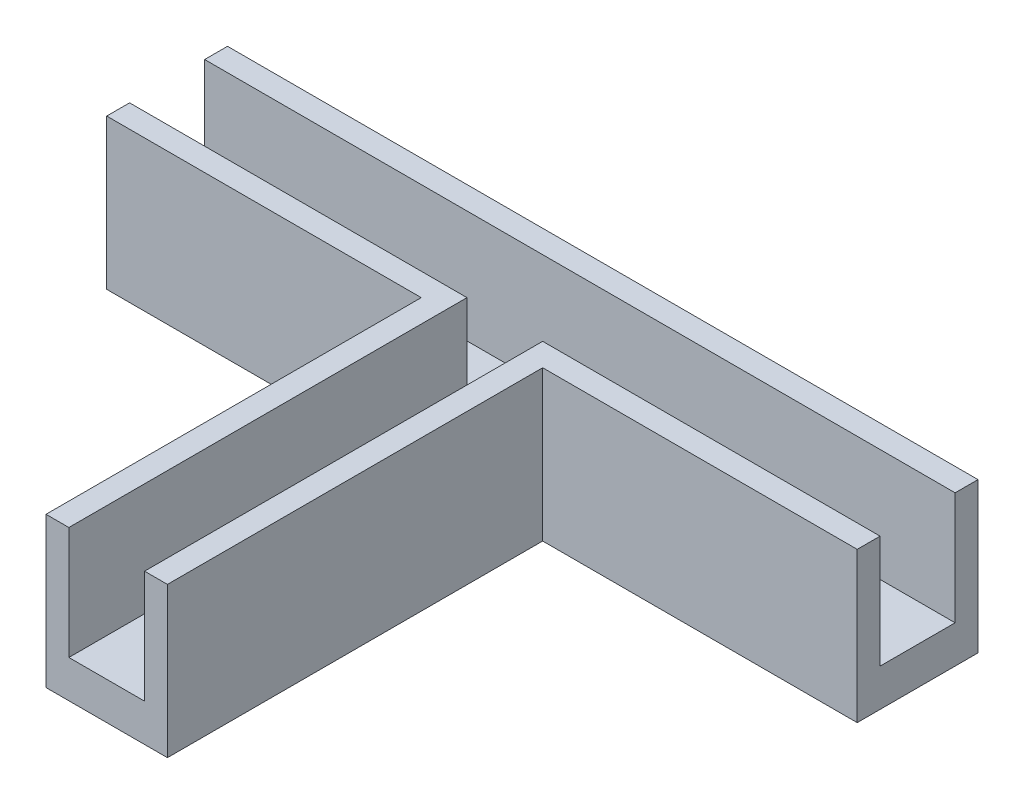
from build123d import *

# Parameters (mm, degrees)
BOSS_EXTRUDE1_DEPTH = 2.5
BOSS_EXTRUDE2_DEPTH = 2.5
SKETCH1_6_W         = 50
SKETCH1_6_H         = 1.524
BOSS_EXTRUDE3_DEPTH = 10


with BuildPart() as part:
    # Sketch1 → Boss-Extrude1 (new body)
    with BuildSketch(Plane(origin=(0, 0, 0), x_dir=(1, 0, 0), z_dir=(0, 1, 0))):
        Polygon((2.521, -2.499999953), (-2.521, -2.499999953), (-2.521, -4.023999953), (-2.521, -29.023999953), (2.521, -29.023999953), (2.521, -4.023999953), align=None)
    extrude(amount=BOSS_EXTRUDE1_DEPTH)

    # Sketch1<5> → Boss-Extrude2 (add)
    with BuildSketch(Plane(origin=(0, 0, 0), x_dir=(1, 0, 0), z_dir=(0, 1, 0))):
        Polygon((25, 2.499999953), (-25, 2.499999953), (-25, -2.499999953), (-2.521, -2.499999953), (2.521, -2.499999953), (25, -2.499999953), align=None)
    extrude(amount=BOSS_EXTRUDE2_DEPTH)

    # Sketch1<6> → Boss-Extrude3 (add)
    with BuildSketch(Plane(origin=(0, 0, 0), x_dir=(1, 0, 0), z_dir=(0, 1, 0))):
        with Locations((0, 3.261999953)):
            Rectangle(SKETCH1_6_W, SKETCH1_6_H)
        Polygon((-2.521, -2.499999953), (-25, -2.499999953), (-25, -4.023999953), (-4.045, -4.023999953), (-4.045, -29.023999953), (-2.521, -29.023999953), align=None)
        Polygon((25, -4.023999953), (25, -2.499999953), (2.521, -2.499999953), (2.521, -29.023999953), (4.045, -29.023999953), (4.045, -4.023999953), align=None)
    extrude(amount=BOSS_EXTRUDE3_DEPTH)


solid = part.part
